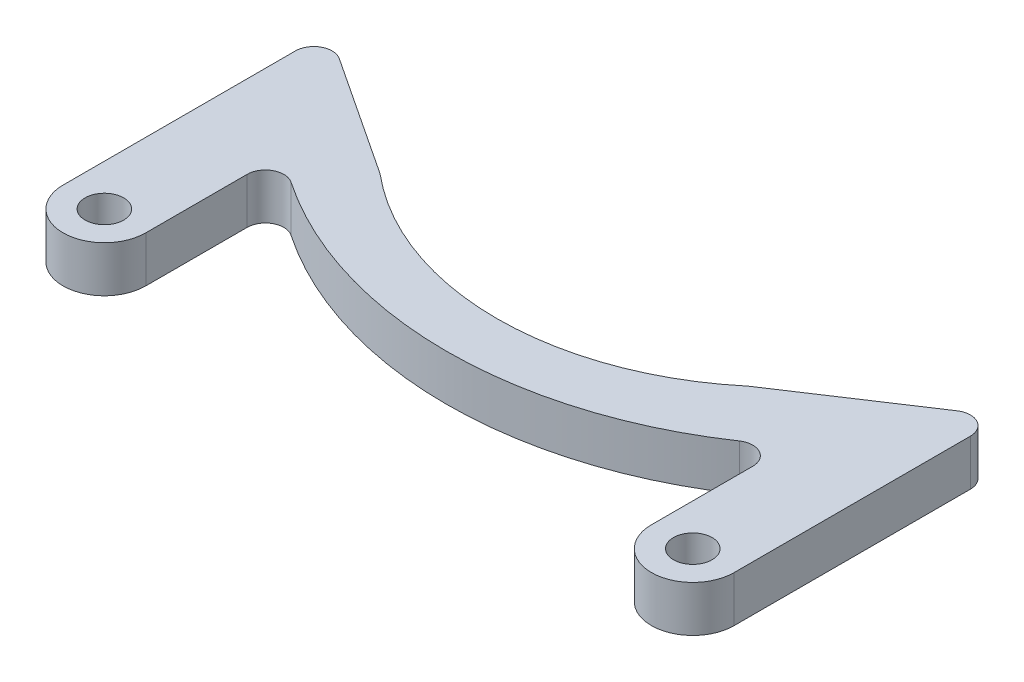
from build123d import *

# Parameters (mm, degrees)
SKETCH1_R           = 2.1
BOSS_EXTRUDE1_DEPTH = 5
FILLET2_R           = 2


with BuildPart() as part:
    # Sketch1 → Boss-Extrude1 (new body)
    with BuildSketch(Plane(origin=(0, 0, 0), x_dir=(1, 0, 0), z_dir=(0, 1, 0))):
        with BuildLine():
            Line((68.5, 0), (68.5, 15))
            Line((68.5, 15), (68.5, 24.639286301))
            Line((68.5, 24.639286301), (68.5, 29.417680708))
            Line((68.5, 29.417680708), (51.680517538, 18.308520556))
            ThreePointArc((51.680517538, 18.308520556), (31.678817451, 11.020026075), (11.677117365, 18.308520556))
            Line((11.677117365, 18.308520556), (-4.5, 28.993402687))
            Line((-4.5, 28.993402687), (-4.5, 0))
            ThreePointArc((-4.5, 0), (0, -4.5), (4.5, 0))
            Line((4.5, 0), (4.5, 15))
            ThreePointArc((4.5, 15), (32, 5.201587921), (59.5, 15))
            Line((59.5, 15), (59.5, 0))
            ThreePointArc((59.5, 0), (64, -4.5), (68.5, 0))
        make_face()
        with Locations(Location((0, 0, 0), (0, 0, 270))):
            Circle(SKETCH1_R, mode=Mode.SUBTRACT)
        with Locations(Location((64, 0, 0), (0, 0, 270))):
            Circle(SKETCH1_R, mode=Mode.SUBTRACT)
    extrude(amount=BOSS_EXTRUDE1_DEPTH)

    # Fillet2
    fillet2_edges = [part.edges().sort_by_distance(p)[0] for p in [
        (59.5, 2.5, -15),
        (4.5, 2.5, -15),
        (-4.5, 2.5, -28.993402687),
        (11.677117365, 2.5, -18.308520556),
        (51.680517538, 2.5, -18.308520556),
        (68.5, 2.5, -29.417680708),
    ]]
    fillet(fillet2_edges, radius=FILLET2_R)


solid = part.part
